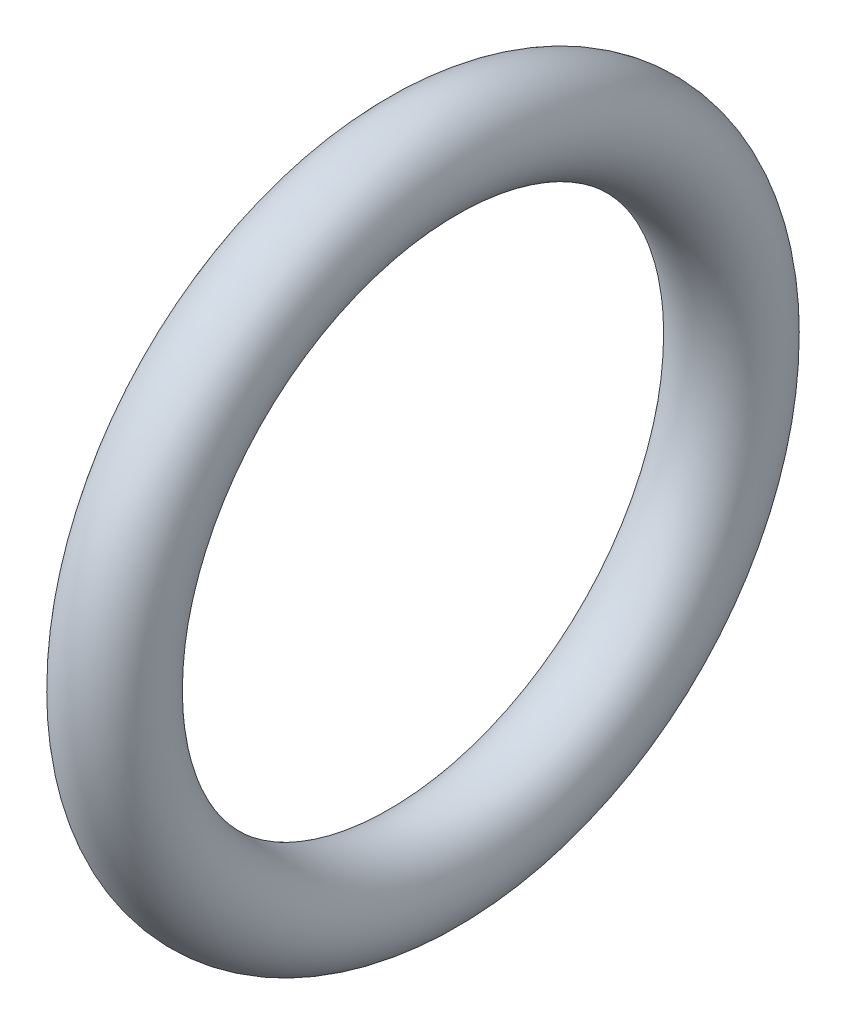
from build123d import *

# Parameters (mm, degrees)
SKETCH1_R = 1.4


with BuildPart() as part:
    # Sketch1 → Revolve1 (revolve)
    with BuildSketch(Plane.XY, mode=Mode.PRIVATE) as revolve1_sk:
        with Locations((0, 9)):
            Circle(SKETCH1_R)
    revolve(revolve1_sk.sketch.rotate(Axis((1.54, 0, 0), (-1, 0, 0)), 90), axis=Axis((1.54, 0, 0), (-1, 0, 0)))


solid = part.part
